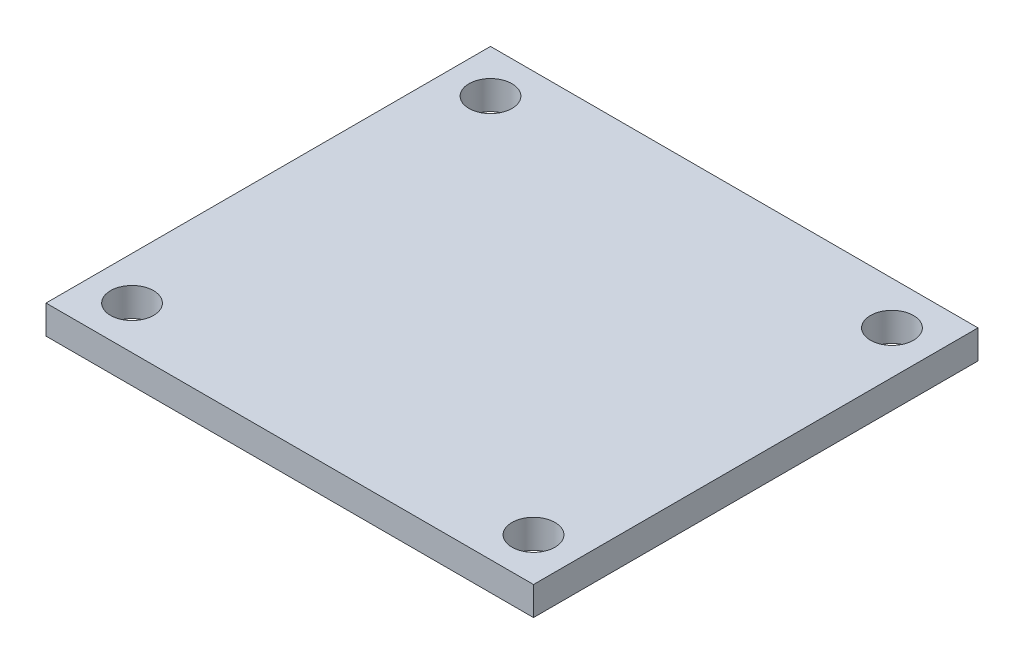
from build123d import *

# Parameters (mm, degrees)
SKETCH1_W           = 34
SKETCH1_H           = 31
SKETCH1_R           = 1.5
BOSS_EXTRUDE1_DEPTH = 2


with BuildPart() as part:
    # Sketch1 → Boss-Extrude1 (new body)
    with BuildSketch(Plane(origin=(0, 0, 0), x_dir=(1, 0, 0), z_dir=(0, 1, 0))):
        with Locations((17, 15.5)):
            Rectangle(SKETCH1_W, SKETCH1_H)
        with Locations(Location((3, 28, 0), (0, 0, 270))):
            Circle(SKETCH1_R, mode=Mode.SUBTRACT)
        with Locations(Location((31, 28, 0), (0, 0, 90))):
            Circle(SKETCH1_R, mode=Mode.SUBTRACT)
        with Locations(Location((31, 3, 0), (0, 0, 270))):
            Circle(SKETCH1_R, mode=Mode.SUBTRACT)
        with Locations(Location((3, 3, 0), (0, 0, 90))):
            Circle(SKETCH1_R, mode=Mode.SUBTRACT)
    extrude(amount=BOSS_EXTRUDE1_DEPTH)


solid = part.part
